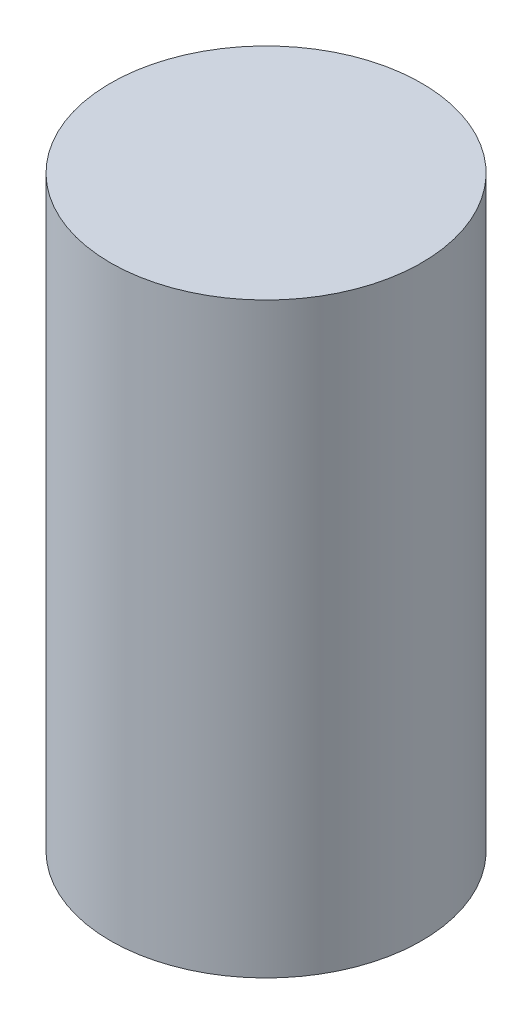
from build123d import *


with BuildPart() as part:
    # Sketch1 → Revolve1 (revolve)
    with BuildSketch(Plane(origin=(0, 0, 0), x_dir=(0, 0, -1), z_dir=(1, 0, 0)), mode=Mode.PRIVATE) as revolve1_sk:
        Polygon((0, 195.2625), (103.5, 195.2625), (103.5, -195.2625), (0, -195.2625), (0, -183.5531), (91.7906, -183.5531), (91.7906, 183.5531), (0, 183.5531), align=None)
    revolve(revolve1_sk.sketch.rotate(Axis((0, 0, 0), (0, -1, 0)), 180), axis=Axis((0, 0, 0), (0, -1, 0)))


solid = part.part
